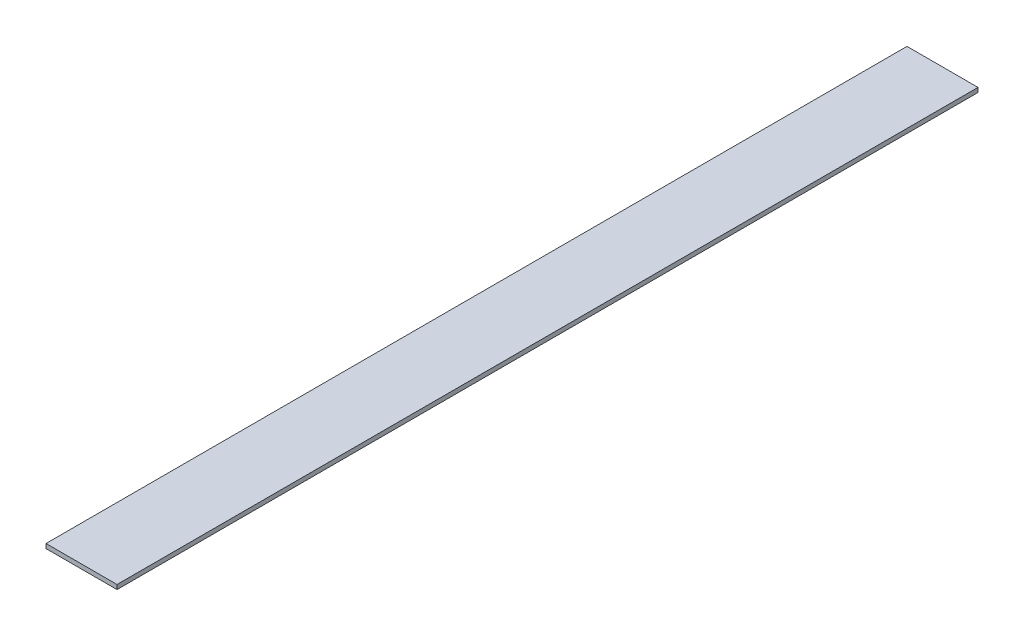
from build123d import *

# Parameters (mm, degrees)
SKETCH1_W           = 50.8
SKETCH1_H           = 615.95
BOSS_EXTRUDE1_DEPTH = 3.175


with BuildPart() as part:
    # Sketch1 → Boss-Extrude1 (new body)
    with BuildSketch(Plane(origin=(0, 0, 0), x_dir=(1, 0, 0), z_dir=(0, 1, 0))):
        Rectangle(SKETCH1_W, SKETCH1_H)
    extrude(amount=BOSS_EXTRUDE1_DEPTH)


solid = part.part
